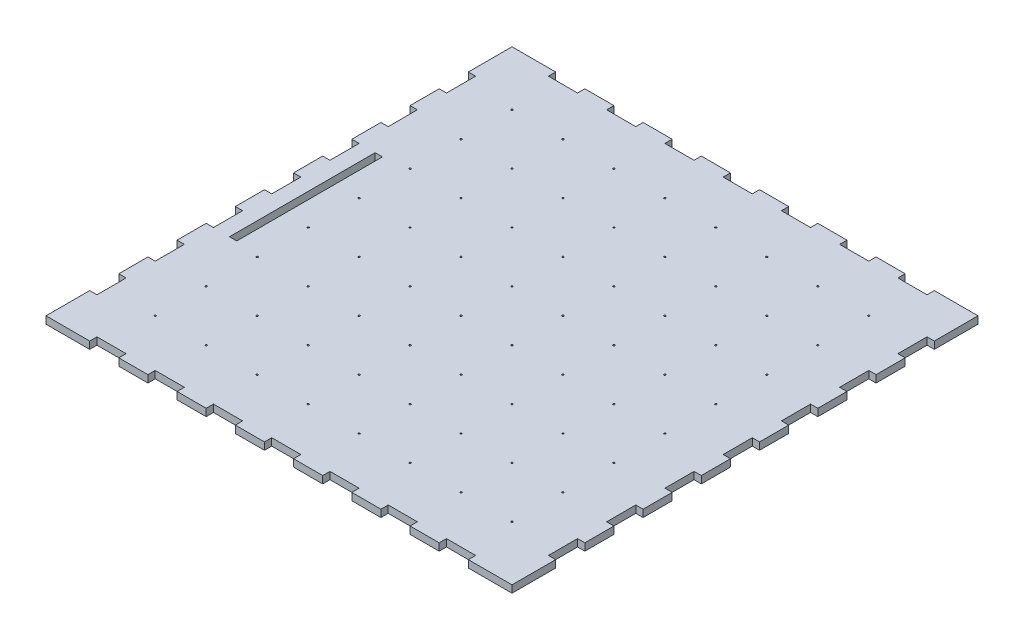
from build123d import *

# Parameters (mm, degrees)
SKETCH1_W           = 160
SKETCH1_H           = 160
BOSS_EXTRUDE1_DEPTH = 1.25
SKETCH3_R           = 0.3
CUT_EXTRUDE2_DEPTH  = 114.164702978
SKETCH4_W           = 10
SKETCH4_H           = 2.5
SKETCH4_W_2         = 2.5
SKETCH4_H_2         = 10
CUT_EXTRUDE3_DEPTH  = 114.164702978
CUT_EXTRUDE4_REACH  = 115.165
SKETCH5_W           = 2.5
SKETCH5_H           = 50


with BuildPart() as part:
    # Sketch1 → Boss-Extrude1 (new, symmetric)
    with BuildSketch(Plane(origin=(0, 0, 0), x_dir=(1, 0, 0), z_dir=(0, 1, 0))):
        Rectangle(SKETCH1_W, SKETCH1_H)
    extrude(amount=BOSS_EXTRUDE1_DEPTH, both=True)

    # Sketch3 → Cut-Extrude2 (cut, through all)
    with BuildSketch(Plane(origin=(0, 1.25, 0), x_dir=(1, 0, 0), z_dir=(0, 1, 0))):
        with Locations(Location((-61.25, -61.25, 0), (0, 0, 270))):
            Circle(SKETCH3_R)
        with Locations(Location((-43.75, -61.25, 0), (0, 0, 270))):
            Circle(SKETCH3_R)
        with Locations(Location((-26.25, -61.25, 0), (0, 0, 270))):
            Circle(SKETCH3_R)
        with Locations(Location((-8.75, -61.25, 0), (0, 0, 270))):
            Circle(SKETCH3_R)
        with Locations(Location((8.75, -61.25, 0), (0, 0, 270))):
            Circle(SKETCH3_R)
        with Locations(Location((26.25, -61.25, 0), (0, 0, 270))):
            Circle(SKETCH3_R)
        with Locations(Location((43.75, -61.25, 0), (0, 0, 270))):
            Circle(SKETCH3_R)
        with Locations(Location((61.25, -61.25, 0), (0, 0, 270))):
            Circle(SKETCH3_R)
        with Locations(Location((-43.75, -43.75, 0), (0, 0, 270))):
            Circle(SKETCH3_R)
        with Locations(Location((-26.25, -43.75, 0), (0, 0, 270))):
            Circle(SKETCH3_R)
        with Locations(Location((-8.75, -43.75, 0), (0, 0, 270))):
            Circle(SKETCH3_R)
        with Locations(Location((8.75, -43.75, 0), (0, 0, 270))):
            Circle(SKETCH3_R)
        with Locations(Location((26.25, -43.75, 0), (0, 0, 270))):
            Circle(SKETCH3_R)
        with Locations(Location((43.75, -43.75, 0), (0, 0, 270))):
            Circle(SKETCH3_R)
        with Locations(Location((61.25, -43.75, 0), (0, 0, 270))):
            Circle(SKETCH3_R)
        with Locations(Location((-43.75, -26.25, 0), (0, 0, 270))):
            Circle(SKETCH3_R)
        with Locations(Location((-26.25, -26.25, 0), (0, 0, 270))):
            Circle(SKETCH3_R)
        with Locations(Location((-8.75, -26.25, 0), (0, 0, 270))):
            Circle(SKETCH3_R)
        with Locations(Location((8.75, -26.25, 0), (0, 0, 270))):
            Circle(SKETCH3_R)
        with Locations(Location((26.25, -26.25, 0), (0, 0, 270))):
            Circle(SKETCH3_R)
        with Locations(Location((43.75, -26.25, 0), (0, 0, 270))):
            Circle(SKETCH3_R)
        with Locations(Location((61.25, -26.25, 0), (0, 0, 270))):
            Circle(SKETCH3_R)
        with Locations(Location((-43.75, -8.75, 0), (0, 0, 270))):
            Circle(SKETCH3_R)
        with Locations(Location((-26.25, -8.75, 0), (0, 0, 270))):
            Circle(SKETCH3_R)
        with Locations(Location((-8.75, -8.75, 0), (0, 0, 270))):
            Circle(SKETCH3_R)
        with Locations(Location((8.75, -8.75, 0), (0, 0, 270))):
            Circle(SKETCH3_R)
        with Locations(Location((26.25, -8.75, 0), (0, 0, 270))):
            Circle(SKETCH3_R)
        with Locations(Location((43.75, -8.75, 0), (0, 0, 270))):
            Circle(SKETCH3_R)
        with Locations(Location((61.25, -8.75, 0), (0, 0, 270))):
            Circle(SKETCH3_R)
        with Locations(Location((-43.75, 8.75, 0), (0, 0, 270))):
            Circle(SKETCH3_R)
        with Locations(Location((-26.25, 8.75, 0), (0, 0, 270))):
            Circle(SKETCH3_R)
        with Locations(Location((-8.75, 8.75, 0), (0, 0, 270))):
            Circle(SKETCH3_R)
        with Locations(Location((8.75, 8.75, 0), (0, 0, 270))):
            Circle(SKETCH3_R)
        with Locations(Location((26.25, 8.75, 0), (0, 0, 270))):
            Circle(SKETCH3_R)
        with Locations(Location((43.75, 8.75, 0), (0, 0, 270))):
            Circle(SKETCH3_R)
        with Locations(Location((61.25, 8.75, 0), (0, 0, 270))):
            Circle(SKETCH3_R)
        with Locations(Location((-43.75, 26.25, 0), (0, 0, 270))):
            Circle(SKETCH3_R)
        with Locations(Location((-26.25, 26.25, 0), (0, 0, 270))):
            Circle(SKETCH3_R)
        with Locations(Location((-8.75, 26.25, 0), (0, 0, 270))):
            Circle(SKETCH3_R)
        with Locations(Location((8.75, 26.25, 0), (0, 0, 270))):
            Circle(SKETCH3_R)
        with Locations(Location((26.25, 26.25, 0), (0, 0, 270))):
            Circle(SKETCH3_R)
        with Locations(Location((43.75, 26.25, 0), (0, 0, 270))):
            Circle(SKETCH3_R)
        with Locations(Location((61.25, 26.25, 0), (0, 0, 270))):
            Circle(SKETCH3_R)
        with Locations(Location((-43.75, 43.75, 0), (0, 0, 270))):
            Circle(SKETCH3_R)
        with Locations(Location((-26.25, 43.75, 0), (0, 0, 270))):
            Circle(SKETCH3_R)
        with Locations(Location((-8.75, 43.75, 0), (0, 0, 270))):
            Circle(SKETCH3_R)
        with Locations(Location((8.75, 43.75, 0), (0, 0, 270))):
            Circle(SKETCH3_R)
        with Locations(Location((26.25, 43.75, 0), (0, 0, 270))):
            Circle(SKETCH3_R)
        with Locations(Location((43.75, 43.75, 0), (0, 0, 270))):
            Circle(SKETCH3_R)
        with Locations(Location((61.25, 43.75, 0), (0, 0, 270))):
            Circle(SKETCH3_R)
        with Locations(Location((-43.75, 61.25, 0), (0, 0, 270))):
            Circle(SKETCH3_R)
        with Locations(Location((-26.25, 61.25, 0), (0, 0, 270))):
            Circle(SKETCH3_R)
        with Locations(Location((-8.75, 61.25, 0), (0, 0, 270))):
            Circle(SKETCH3_R)
        with Locations(Location((8.75, 61.25, 0), (0, 0, 270))):
            Circle(SKETCH3_R)
        with Locations(Location((26.25, 61.25, 0), (0, 0, 270))):
            Circle(SKETCH3_R)
        with Locations(Location((43.75, 61.25, 0), (0, 0, 270))):
            Circle(SKETCH3_R)
        with Locations(Location((61.25, 61.25, 0), (0, 0, 270))):
            Circle(SKETCH3_R)
        with Locations(Location((-61.25, -43.75, 0), (0, 0, 270))):
            Circle(SKETCH3_R)
        with Locations(Location((-61.25, -26.25, 0), (0, 0, 270))):
            Circle(SKETCH3_R)
        with Locations(Location((-61.25, -8.75, 0), (0, 0, 270))):
            Circle(SKETCH3_R)
        with Locations(Location((-61.25, 8.75, 0), (0, 0, 270))):
            Circle(SKETCH3_R)
        with Locations(Location((-61.25, 26.25, 0), (0, 0, 270))):
            Circle(SKETCH3_R)
        with Locations(Location((-61.25, 43.75, 0), (0, 0, 270))):
            Circle(SKETCH3_R)
        with Locations(Location((-61.25, 61.25, 0), (0, 0, 270))):
            Circle(SKETCH3_R)
    extrude(amount=-CUT_EXTRUDE2_DEPTH, mode=Mode.SUBTRACT)

    # Sketch4 → Cut-Extrude3 (cut, through all)
    with BuildSketch(Plane(origin=(0, 1.25, 0), x_dir=(1, 0, 0), z_dir=(0, 1, 0))):
        with Locations((60, 78.75)):
            Rectangle(SKETCH4_W, SKETCH4_H)
        with Locations((78.75, 60)):
            Rectangle(SKETCH4_W_2, SKETCH4_H_2)
        with Locations((40, 78.75)):
            Rectangle(SKETCH4_W, SKETCH4_H)
        with Locations((78.75, 40)):
            Rectangle(SKETCH4_W_2, SKETCH4_H_2)
        with Locations((20, 78.75)):
            Rectangle(SKETCH4_W, SKETCH4_H)
        with Locations((78.75, 20)):
            Rectangle(SKETCH4_W_2, SKETCH4_H_2)
        with Locations((0, 78.75)):
            Rectangle(SKETCH4_W, SKETCH4_H)
        with Locations((78.75, 0)):
            Rectangle(SKETCH4_W_2, SKETCH4_H_2)
        with Locations((-20, 78.75)):
            Rectangle(SKETCH4_W, SKETCH4_H)
        with Locations((78.75, -20)):
            Rectangle(SKETCH4_W_2, SKETCH4_H_2)
        with Locations((-40, 78.75)):
            Rectangle(SKETCH4_W, SKETCH4_H)
        with Locations((78.75, -40)):
            Rectangle(SKETCH4_W_2, SKETCH4_H_2)
        with Locations((-60, 78.75)):
            Rectangle(SKETCH4_W, SKETCH4_H)
        with Locations((78.75, -60)):
            Rectangle(SKETCH4_W_2, SKETCH4_H_2)
        with Locations((-78.75, 60)):
            Rectangle(SKETCH4_W_2, SKETCH4_H_2)
        with Locations((60, -78.75)):
            Rectangle(SKETCH4_W, SKETCH4_H)
        with Locations((-78.75, 40)):
            Rectangle(SKETCH4_W_2, SKETCH4_H_2)
        with Locations((40, -78.75)):
            Rectangle(SKETCH4_W, SKETCH4_H)
        with Locations((-78.75, 20)):
            Rectangle(SKETCH4_W_2, SKETCH4_H_2)
        with Locations((20, -78.75)):
            Rectangle(SKETCH4_W, SKETCH4_H)
        with Locations((-78.75, 0)):
            Rectangle(SKETCH4_W_2, SKETCH4_H_2)
        with Locations((0, -78.75)):
            Rectangle(SKETCH4_W, SKETCH4_H)
        with Locations((-78.75, -20)):
            Rectangle(SKETCH4_W_2, SKETCH4_H_2)
        with Locations((-20, -78.75)):
            Rectangle(SKETCH4_W, SKETCH4_H)
        with Locations((-78.75, -40)):
            Rectangle(SKETCH4_W_2, SKETCH4_H_2)
        with Locations((-40, -78.75)):
            Rectangle(SKETCH4_W, SKETCH4_H)
        with Locations((-78.75, -60)):
            Rectangle(SKETCH4_W_2, SKETCH4_H_2)
        with Locations((-60, -78.75)):
            Rectangle(SKETCH4_W, SKETCH4_H)
    extrude(amount=-CUT_EXTRUDE3_DEPTH, mode=Mode.SUBTRACT)

    # Sketch5 → Cut-Extrude4 (cut, up to next)
    with BuildSketch(Plane(origin=(0, 1.25, 0), x_dir=(1, 0, 0), z_dir=(0, 1, 0)), mode=Mode.PRIVATE) as cut_extrude4_sk1:
        with Locations((-70.75, 0)):
            Rectangle(SKETCH5_W, SKETCH5_H)
    cut_extrude4_tool1 = extrude(cut_extrude4_sk1.sketch, amount=-CUT_EXTRUDE4_REACH, mode=Mode.PRIVATE) & part.part
    add(cut_extrude4_tool1.solids().sort_by_distance((-70.75, 1.25, 0))[0], mode=Mode.SUBTRACT)


solid = part.part
